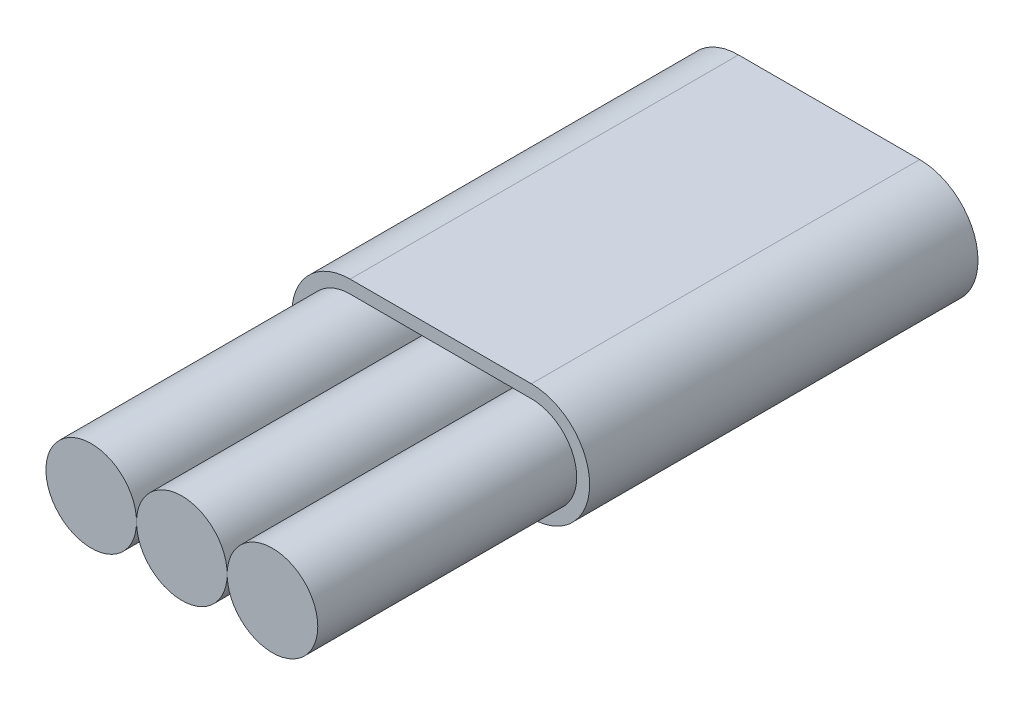
from build123d import *

# Parameters (mm, degrees)
SKETCH2_R             = 1.75
BOSS_EXTRUDE1_DEPTH   = 25
BOSS_EXTRUDE1_2_DEPTH = 25
BOSS_EXTRUDE1_3_DEPTH = 25
EXTRUDE_THIN1_DEPTH   = 15


with BuildPart() as part:
    # Sketch2 → Boss-Extrude1 (new body)
    with BuildSketch(Plane.XY):
        with Locations((3.5, 0)):
            Circle(SKETCH2_R)
    extrude(amount=BOSS_EXTRUDE1_DEPTH)


with BuildPart() as body_2:
    # Sketch2 → Boss-Extrude1 2 (new body)
    with BuildSketch(Plane.XY):
        Circle(SKETCH2_R)
    extrude(amount=BOSS_EXTRUDE1_2_DEPTH)


with BuildPart() as body_3:
    # Sketch2 → Boss-Extrude1 3 (new body)
    with BuildSketch(Plane.XY):
        with Locations((-3.5, 0)):
            Circle(SKETCH2_R)
    extrude(amount=BOSS_EXTRUDE1_3_DEPTH)


with BuildPart() as body_4:
    # Sketch3 → Extrude-Thin1 (new body)
    with BuildSketch(Plane.XY):
        with BuildLine():
            Line((3.5, -2.25), (-3.5, -2.25))
            ThreePointArc((-3.5, -2.25), (-5.75, 0), (-3.5, 2.25))
            Line((-3.5, 2.25), (3.5, 2.25))
            ThreePointArc((3.5, 2.25), (5.75, 0), (3.5, -2.25))
        make_face()
        with BuildLine():
            Line((3.5, -1.75), (-3.5, -1.75))
            ThreePointArc((-3.5, -1.75), (-5.25, 0), (-3.5, 1.75))
            Line((-3.5, 1.75), (3.5, 1.75))
            ThreePointArc((3.5, 1.75), (5.25, 0), (3.5, -1.75))
        make_face(mode=Mode.SUBTRACT)
    extrude(amount=EXTRUDE_THIN1_DEPTH)


solid = Compound([part.part, body_2.part, body_3.part, body_4.part])
